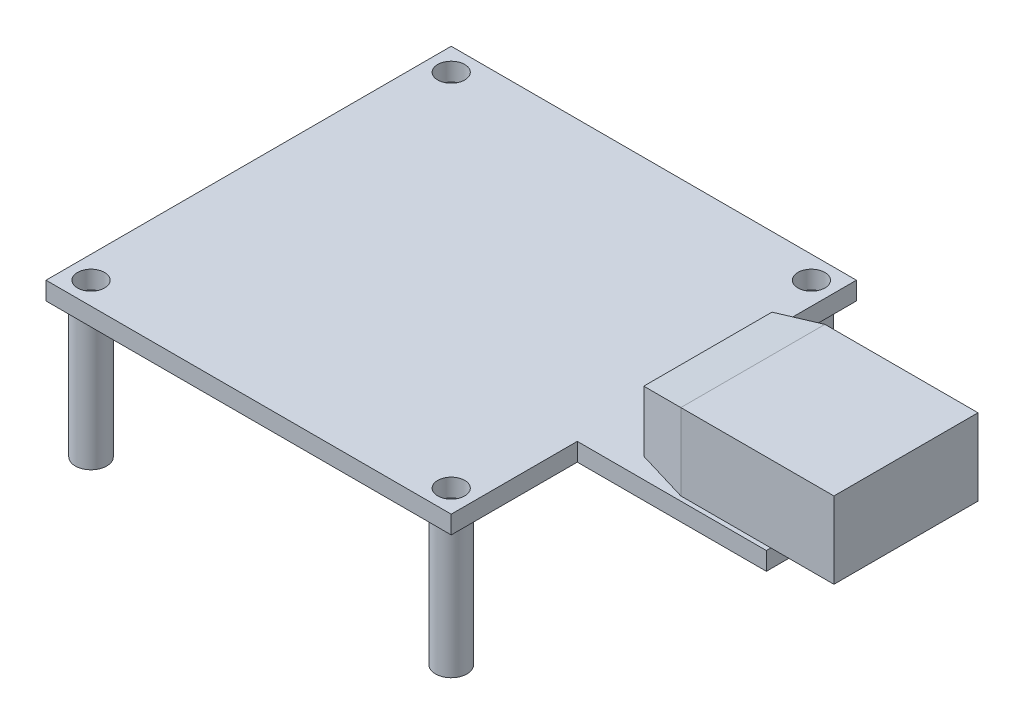
from build123d import *

# Parameters (mm, degrees)
SKETCH_1_W           = 45
SKETCH_1_H           = 45
SKETCH_1_R           = 1.5
SKETCH_1_W_2         = 21
SKETCH_1_H_2         = 17
EXTRUDE_1_DEPTH      = 2
SKETCH_2_R           = 1.75
SKETCH_2_R_2         = 1
EXTRUDE_2_DEPTH      = 15
EXTRUDE_2_2_DEPTH    = 15
EXTRUDE_2_3_DEPTH    = 15
EXTRUDE_2_4_DEPTH    = 15
EXTRUDE_3_DEPTH      = 7
EXTRUDE_3_DEPTH_BACK = 10
SKETCH_5_W           = 16
SKETCH_5_H           = 8.5
SKETCH_6_W           = 16
SKETCH_6_H           = 8.5
EXTRUDE_4_DEPTH      = 5
EXTRUDE_4_TAPER      = 10


with BuildPart() as part:
    # 草图1 → 凸台-拉伸1 (new body)
    # profile 1 of 2: a face of its own
    with BuildSketch(Plane(origin=(0, 0, 0), x_dir=(1, 0, 0), z_dir=(0, 1, 0))):
        Rectangle(SKETCH_1_W, SKETCH_1_H)
        with Locations(Location((20, -20, 0), (0, 0, 270))):
            Circle(SKETCH_1_R, mode=Mode.SUBTRACT)
        with Locations(Location((20, 20, 0), (0, 0, 270))):
            Circle(SKETCH_1_R, mode=Mode.SUBTRACT)
        with Locations(Location((-20, 20, 0), (0, 0, 270))):
            Circle(SKETCH_1_R, mode=Mode.SUBTRACT)
        with Locations(Location((-20, -20, 0), (0, 0, 270))):
            Circle(SKETCH_1_R, mode=Mode.SUBTRACT)
    # profile 2 of 2: a face of its own
    with BuildSketch(Plane(origin=(0, 0, 0), x_dir=(1, 0, 0), z_dir=(0, 1, 0))):
        with Locations((33, 0)):
            Rectangle(SKETCH_1_W_2, SKETCH_1_H_2)
    extrude(amount=EXTRUDE_1_DEPTH)



with BuildPart() as body_2:
    # 草图2 → 凸台-拉伸2 (new body)
    with BuildSketch(Plane.XZ):
        with Locations(Location((-20, 20, 0), (0, 0, 270))):
            Circle(SKETCH_2_R)
        with Locations(Location((-20, 20, 0), (0, 0, 270))):
            Circle(SKETCH_2_R_2, mode=Mode.SUBTRACT)
    extrude(amount=EXTRUDE_2_DEPTH)


with BuildPart() as body_3:
    # 草图2 → Extrude 2 2 (new body)
    with BuildSketch(Plane.XZ):
        with Locations(Location((20, 20, 0), (0, 0, 90))):
            Circle(SKETCH_2_R)
        with Locations(Location((20, 20, 0), (0, 0, 90))):
            Circle(SKETCH_2_R_2, mode=Mode.SUBTRACT)
    extrude(amount=EXTRUDE_2_2_DEPTH)


with BuildPart() as body_4:
    # 草图2 → Extrude 2 3 (new body)
    with BuildSketch(Plane.XZ):
        with Locations(Location((20, -20, 0), (0, 0, 270))):
            Circle(SKETCH_2_R)
        with Locations(Location((20, -20, 0), (0, 0, 270))):
            Circle(SKETCH_2_R_2, mode=Mode.SUBTRACT)
    extrude(amount=EXTRUDE_2_3_DEPTH)


with BuildPart() as body_5:
    # 草图2 → Extrude 2 4 (new body)
    with BuildSketch(Plane.XZ):
        with Locations(Location((-20, -20, 0), (0, 0, 90))):
            Circle(SKETCH_2_R)
        with Locations(Location((-20, -20, 0), (0, 0, 90))):
            Circle(SKETCH_2_R_2, mode=Mode.SUBTRACT)
    extrude(amount=EXTRUDE_2_4_DEPTH)


with BuildPart() as body_6:
    # 草图5 → 凸台-拉伸3 (new, two sides: drawn at the far end of the back side and taken through both)
    with BuildSketch(Plane(origin=(43.5, 0, 0), x_dir=(0, 0, -1), z_dir=(1, 0, 0)).offset(-EXTRUDE_3_DEPTH_BACK)):
        with Locations((0, 6.25)):
            Rectangle(SKETCH_5_W, SKETCH_5_H)
    extrude(amount=EXTRUDE_3_DEPTH + EXTRUDE_3_DEPTH_BACK)


with BuildPart() as part_1:
    add(part.part)

    add(body_6.part)  # 凸台-拉伸4 merges body 6
    # 草图6 → 凸台-拉伸4 (add)
    with BuildSketch(Plane.ZY.offset(-33.5)):
        with Locations((0, 6.25)):
            Rectangle(SKETCH_6_W, SKETCH_6_H)
    extrude(amount=EXTRUDE_4_DEPTH, taper=EXTRUDE_4_TAPER)


solid = Compound([body_2.part, body_3.part, body_4.part, body_5.part, part_1.part])
